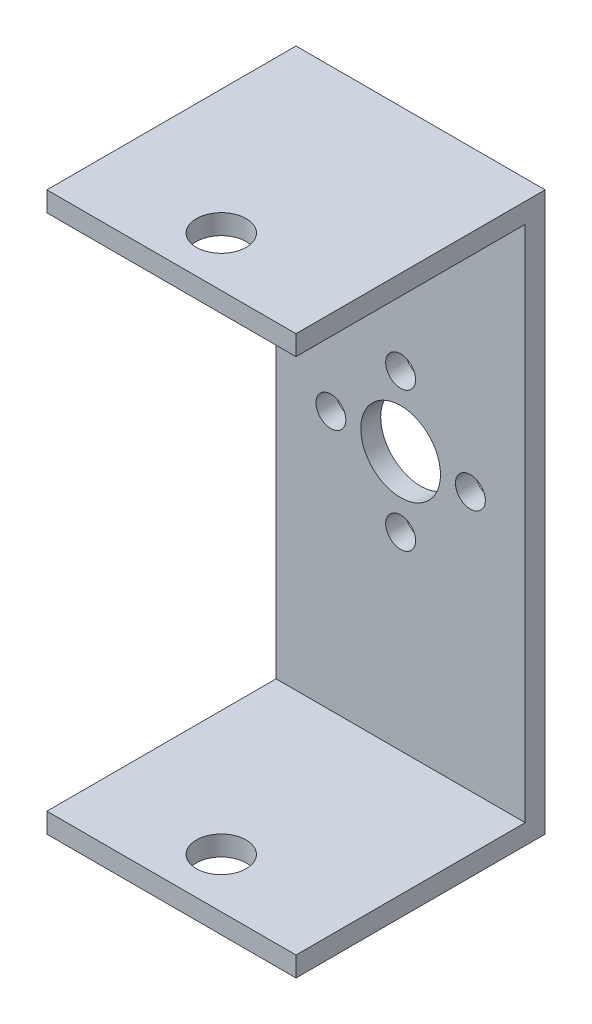
from build123d import *

# Parameters (mm, degrees)
SKETCH1_W           = 25
SKETCH1_H           = 52
BOSS_EXTRUDE1_DEPTH = 2
SKETCH2_W           = 25
SKETCH2_H           = 25
BOSS_EXTRUDE2_DEPTH = 2
SKETCH3_W           = 25
SKETCH3_H           = 25
BOSS_EXTRUDE3_DEPTH = 2
SKETCH5_R           = 4
CUT_EXTRUDE2_DEPTH  = 21
SKETCH6_R           = 1.5
CUT_EXTRUDE3_DEPTH  = 21
SKETCH7_R           = 2.5
CUT_EXTRUDE4_DEPTH  = 81


with BuildPart() as part:
    # Sketch1 → Boss-Extrude1 (new body)
    with BuildSketch(Plane.XY):
        with Locations((-0.174770451, 4.502942624)):
            Rectangle(SKETCH1_W, SKETCH1_H)
    extrude(amount=BOSS_EXTRUDE1_DEPTH)

    # Sketch2 → Boss-Extrude2 (add)
    with BuildSketch(Plane(origin=(0, 30.502942624, 0), x_dir=(1, 0, 0), z_dir=(0, 1, 0))):
        with Locations((-0.174770451, -12.5)):
            Rectangle(SKETCH2_W, SKETCH2_H)
    extrude(amount=BOSS_EXTRUDE2_DEPTH)

    # Sketch3 → Boss-Extrude3 (add)
    with BuildSketch(Plane(origin=(0, -21.497057376, 0), x_dir=(-1, 0, 0), z_dir=(0, -1, 0))):
        with Locations((0.174770451, -12.5)):
            Rectangle(SKETCH3_W, SKETCH3_H)
    extrude(amount=BOSS_EXTRUDE3_DEPTH)

    # Sketch5 → Cut-Extrude2 (cut)
    with BuildSketch(Plane(origin=(0, 0, 0), x_dir=(-1, 0, 0), z_dir=(0, 0, -1))):
        with Locations((0.174770451, 4.502942624)):
            Circle(SKETCH5_R)
    extrude(amount=-CUT_EXTRUDE2_DEPTH, mode=Mode.SUBTRACT)

    # Sketch6 → Cut-Extrude3 (cut)
    with BuildSketch(Plane(origin=(0, 0, 0), x_dir=(-1, 0, 0), z_dir=(0, 0, -1))):
        with Locations((7.174770451, 4.502942624)):
            Circle(SKETCH6_R)
        with Locations((0.174770451, -2.497057376)):
            Circle(SKETCH6_R)
        with Locations((-6.825229549, 4.502942624)):
            Circle(SKETCH6_R)
        with Locations((0.174770451, 11.502942624)):
            Circle(SKETCH6_R)
    extrude(amount=-CUT_EXTRUDE3_DEPTH, mode=Mode.SUBTRACT)

    # Sketch7 → Cut-Extrude4 (cut)
    with BuildSketch(Plane(origin=(0, -23.497057376, 0), x_dir=(-1, 0, 0), z_dir=(0, -1, 0))):
        with Locations(Location((0.174770451, -20, 0), (0, 0, 90))):
            Circle(SKETCH7_R)
    extrude(amount=-CUT_EXTRUDE4_DEPTH, mode=Mode.SUBTRACT)


solid = part.part
